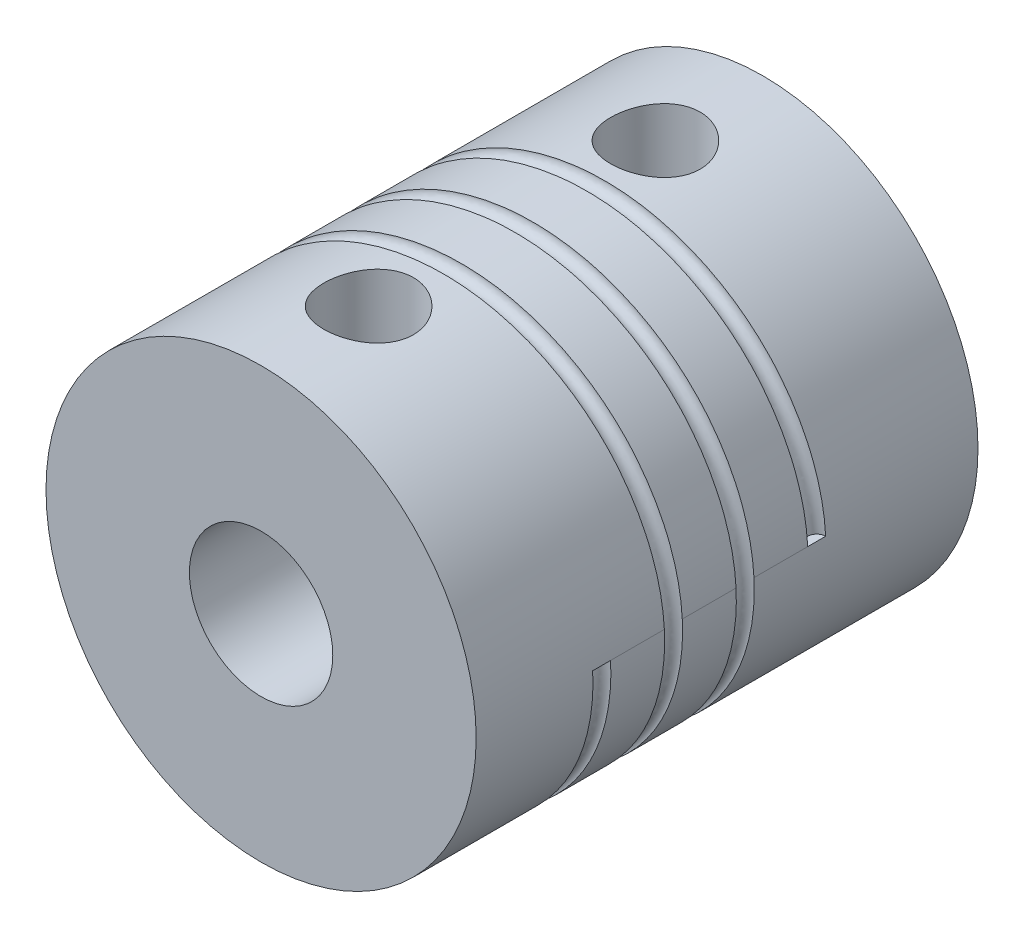
from build123d import *

# Parameters (mm, degrees)
SKETCH_1_R          = 6
SKETCH_1_R_2        = 1.5
EXTRUDE_1_DEPTH     = 14
SKETCH_2_R          = 1.25
CUT_EXTRUDE_1_DEPTH = 7
SWEEP_1_PITCH       = 2
SWEEP_1_HEIGHT      = 6
SWEEP_1_RADIUS      = 6
SKETCH_4_R          = 0.25
SKETCH_5_R          = 2
CUT_EXTRUDE_2_DEPTH = 9


with BuildPart() as part:
    # 草图1 → 凸台-拉伸1 (new body)
    with BuildSketch(Plane.XY):
        Circle(SKETCH_1_R)
        Circle(SKETCH_1_R_2, mode=Mode.SUBTRACT)
    extrude(amount=EXTRUDE_1_DEPTH)

    # 草图2 → 切除-拉伸1 (cut)
    with BuildSketch(Plane(origin=(0, 0, 0), x_dir=(1, 0, 0), z_dir=(0, 1, 0))):
        with Locations(Location((0, -3, 0), (0, 0, 90))):
            Circle(SKETCH_2_R)
        with Locations(Location((0, -11, 0), (0, 0, 90))):
            Circle(SKETCH_2_R)
    extrude(amount=CUT_EXTRUDE_1_DEPTH, mode=Mode.SUBTRACT)

    # 切除-扫描1: sweep along a helix
    with BuildLine() as sweep_1_path:
        Helix(SWEEP_1_PITCH, SWEEP_1_HEIGHT, SWEEP_1_RADIUS, center=(0, 0, 4.5), direction=(0, 0, 1))
    # 草图4 → 切除-扫描1 (sweep, cut)
    with BuildSketch(Plane(origin=(0, 0, 0), x_dir=(1, 0, 0), z_dir=(0, 1, 0))):
        with Locations((6, -10.5)):
            Circle(SKETCH_4_R)
    sweep(path=sweep_1_path.line, is_frenet=True, mode=Mode.SUBTRACT)

    # 草图5 → 切除-拉伸2 (cut)
    with BuildSketch(Plane.XY.offset(14)):
        Circle(SKETCH_5_R)
    extrude(amount=-CUT_EXTRUDE_2_DEPTH, mode=Mode.SUBTRACT)


solid = part.part
